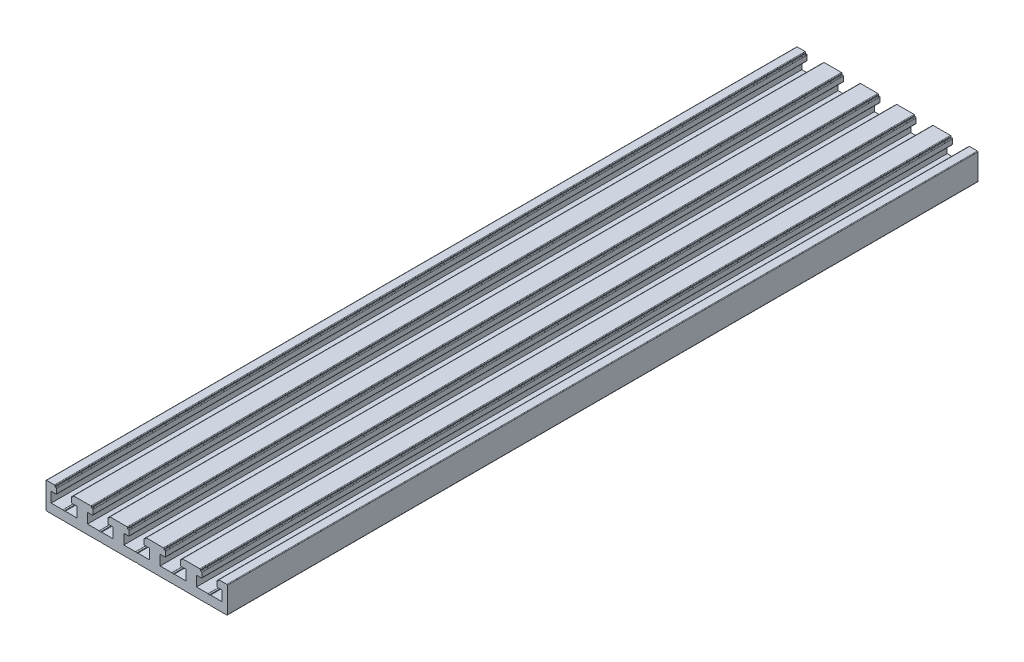
from build123d import *

# Parameters (mm, degrees)
BASE_DEPTH                                      = 310
CSK_FOR_M3_FLAT_HEAD_MACHINE_SCREW1_D           = 3.2
CSK_FOR_M3_FLAT_HEAD_MACHINE_SCREW1_CSINK_D     = 6
CSK_FOR_M3_FLAT_HEAD_MACHINE_SCREW1_CSINK_ANGLE = 90
M4X0_7_TAPPED_HOLE1_D                           = 3.3


with BuildPart() as part:
    # Sketch1 → Base (new body)
    with BuildSketch(Plane(origin=(0, 0, 0), x_dir=(-1, 0, 0), z_dir=(0, 0, -1))):
        with BuildLine():
            Line((-37.45, 8.85), (-37.45, -1.65))
            ThreePointArc((-37.45, -1.65), (-37.376776695, -1.826776695), (-37.2, -1.9))
            Line((-37.2, -1.9), (-30.543629459, -1.9))
            ThreePointArc((-30.543629459, -1.9), (-30.500649598, -1.896277753), (-30.458949592, -1.885221853))
            Line((-30.458949592, -1.885221853), (-30, -1.72))
            Line((-30, -1.72), (-29.541050408, -1.885221853))
            ThreePointArc((-29.541050408, -1.885221853), (-29.499350402, -1.896277753), (-29.456370541, -1.9))
            Line((-29.456370541, -1.9), (-15.543629459, -1.9))
            ThreePointArc((-15.543629459, -1.9), (-15.500649598, -1.896277753), (-15.458949592, -1.885221853))
            Line((-15.458949592, -1.885221853), (-15, -1.72))
            Line((-15, -1.72), (-14.541050408, -1.885221853))
            ThreePointArc((-14.541050408, -1.885221853), (-14.499350402, -1.896277753), (-14.456370541, -1.9))
            Line((-14.456370541, -1.9), (-0.543629459, -1.9))
            ThreePointArc((-0.543629459, -1.9), (-0.500649598, -1.896277753), (-0.458949592, -1.885221853))
            Line((-0.458949592, -1.885221853), (0, -1.72))
            Line((0, -1.72), (0.458949592, -1.885221853))
            ThreePointArc((0.458949592, -1.885221853), (0.500649598, -1.896277753), (0.543629459, -1.9))
            Line((0.543629459, -1.9), (14.456370541, -1.9))
            ThreePointArc((14.456370541, -1.9), (14.499350402, -1.896277753), (14.541050408, -1.885221853))
            Line((14.541050408, -1.885221853), (15, -1.72))
            Line((15, -1.72), (15.458949592, -1.885221853))
            ThreePointArc((15.458949592, -1.885221853), (15.500649598, -1.896277753), (15.543629459, -1.9))
            Line((15.543629459, -1.9), (29.456370541, -1.9))
            ThreePointArc((29.456370541, -1.9), (29.499350402, -1.896277753), (29.541050408, -1.885221853))
            Line((29.541050408, -1.885221853), (30, -1.72))
            Line((30, -1.72), (30.458949592, -1.885221853))
            ThreePointArc((30.458949592, -1.885221853), (30.500649598, -1.896277753), (30.543629459, -1.9))
            Line((30.543629459, -1.9), (37.2, -1.9))
            ThreePointArc((37.2, -1.9), (37.376776695, -1.826776695), (37.45, -1.65))
            Line((37.45, -1.65), (37.45, 8.85))
            ThreePointArc((37.45, 8.85), (37.376776695, 9.026776695), (37.2, 9.1))
            Line((37.2, 9.1), (33.95, 9.1))
            ThreePointArc((33.95, 9.1), (33.773223305, 9.026776695), (33.7, 8.85))
            Line((33.7, 8.85), (33.7, 8.5))
            Line((33.7, 8.5), (33.32, 8.5))
            ThreePointArc((33.32, 8.5), (33.143223305, 8.426776695), (33.07, 8.25))
            Line((33.07, 8.25), (33.07, 6.35))
            ThreePointArc((33.07, 6.35), (33.143223305, 6.173223305), (33.32, 6.1))
            Line((33.32, 6.1), (35.3, 6.1))
            Line((35.3, 6.1), (35.3, 1.9))
            Line((35.3, 1.9), (30.543629459, 1.9))
            ThreePointArc((30.543629459, 1.9), (30.500649598, 1.896277753), (30.458949592, 1.885221853))
            Line((30.458949592, 1.885221853), (30, 1.72))
            Line((30, 1.72), (29.541050408, 1.885221853))
            ThreePointArc((29.541050408, 1.885221853), (29.499350402, 1.896277753), (29.456370541, 1.9))
            Line((29.456370541, 1.9), (24.7, 1.9))
            Line((24.7, 1.9), (24.7, 6.1))
            Line((24.7, 6.1), (26.68, 6.1))
            ThreePointArc((26.68, 6.1), (26.856776695, 6.173223305), (26.93, 6.35))
            Line((26.93, 6.35), (26.93, 8.25))
            ThreePointArc((26.93, 8.25), (26.856776695, 8.426776695), (26.68, 8.5))
            Line((26.68, 8.5), (26.3, 8.5))
            Line((26.3, 8.5), (26.3, 8.85))
            ThreePointArc((26.3, 8.85), (26.226776695, 9.026776695), (26.05, 9.1))
            Line((26.05, 9.1), (18.95, 9.1))
            ThreePointArc((18.95, 9.1), (18.773223305, 9.026776695), (18.7, 8.85))
            Line((18.7, 8.85), (18.7, 8.5))
            Line((18.7, 8.5), (18.32, 8.5))
            ThreePointArc((18.32, 8.5), (18.143223305, 8.426776695), (18.07, 8.25))
            Line((18.07, 8.25), (18.07, 6.35))
            ThreePointArc((18.07, 6.35), (18.143223305, 6.173223305), (18.32, 6.1))
            Line((18.32, 6.1), (20.3, 6.1))
            Line((20.3, 6.1), (20.3, 1.9))
            Line((20.3, 1.9), (15.543629459, 1.9))
            ThreePointArc((15.543629459, 1.9), (15.500649598, 1.896277753), (15.458949592, 1.885221853))
            Line((15.458949592, 1.885221853), (15, 1.72))
            Line((15, 1.72), (14.541050408, 1.885221853))
            ThreePointArc((14.541050408, 1.885221853), (14.499350402, 1.896277753), (14.456370541, 1.9))
            Line((14.456370541, 1.9), (9.7, 1.9))
            Line((9.7, 1.9), (9.7, 6.1))
            Line((9.7, 6.1), (11.68, 6.1))
            ThreePointArc((11.68, 6.1), (11.856776695, 6.173223305), (11.93, 6.35))
            Line((11.93, 6.35), (11.93, 8.25))
            ThreePointArc((11.93, 8.25), (11.856776695, 8.426776695), (11.68, 8.5))
            Line((11.68, 8.5), (11.3, 8.5))
            Line((11.3, 8.5), (11.3, 8.85))
            ThreePointArc((11.3, 8.85), (11.226776695, 9.026776695), (11.05, 9.1))
            Line((11.05, 9.1), (3.95, 9.1))
            ThreePointArc((3.95, 9.1), (3.773223305, 9.026776695), (3.7, 8.85))
            Line((3.7, 8.85), (3.7, 8.5))
            Line((3.7, 8.5), (3.32, 8.5))
            ThreePointArc((3.32, 8.5), (3.143223305, 8.426776695), (3.07, 8.25))
            Line((3.07, 8.25), (3.07, 6.35))
            ThreePointArc((3.07, 6.35), (3.143223305, 6.173223305), (3.32, 6.1))
            Line((3.32, 6.1), (5.3, 6.1))
            Line((5.3, 6.1), (5.3, 1.9))
            Line((5.3, 1.9), (0.543629459, 1.9))
            ThreePointArc((0.543629459, 1.9), (0.500649598, 1.896277753), (0.458949592, 1.885221853))
            Line((0.458949592, 1.885221853), (0, 1.72))
            Line((0, 1.72), (-0.458949592, 1.885221853))
            ThreePointArc((-0.458949592, 1.885221853), (-0.500649598, 1.896277753), (-0.543629459, 1.9))
            Line((-0.543629459, 1.9), (-5.3, 1.9))
            Line((-5.3, 1.9), (-5.3, 6.1))
            Line((-5.3, 6.1), (-3.32, 6.1))
            ThreePointArc((-3.32, 6.1), (-3.143223305, 6.173223305), (-3.07, 6.35))
            Line((-3.07, 6.35), (-3.07, 8.25))
            ThreePointArc((-3.07, 8.25), (-3.143223305, 8.426776695), (-3.32, 8.5))
            Line((-3.32, 8.5), (-3.7, 8.5))
            Line((-3.7, 8.5), (-3.7, 8.85))
            ThreePointArc((-3.7, 8.85), (-3.773223305, 9.026776695), (-3.95, 9.1))
            Line((-3.95, 9.1), (-11.05, 9.1))
            ThreePointArc((-11.05, 9.1), (-11.226776695, 9.026776695), (-11.3, 8.85))
            Line((-11.3, 8.85), (-11.3, 8.5))
            Line((-11.3, 8.5), (-11.68, 8.5))
            ThreePointArc((-11.68, 8.5), (-11.856776695, 8.426776695), (-11.93, 8.25))
            Line((-11.93, 8.25), (-11.93, 6.35))
            ThreePointArc((-11.93, 6.35), (-11.856776695, 6.173223305), (-11.68, 6.1))
            Line((-11.68, 6.1), (-9.7, 6.1))
            Line((-9.7, 6.1), (-9.7, 1.9))
            Line((-9.7, 1.9), (-14.456370541, 1.9))
            ThreePointArc((-14.456370541, 1.9), (-14.499350402, 1.896277753), (-14.541050408, 1.885221853))
            Line((-14.541050408, 1.885221853), (-15, 1.72))
            Line((-15, 1.72), (-15.458949592, 1.885221853))
            ThreePointArc((-15.458949592, 1.885221853), (-15.500649598, 1.896277753), (-15.543629459, 1.9))
            Line((-15.543629459, 1.9), (-20.3, 1.9))
            Line((-20.3, 1.9), (-20.3, 6.1))
            Line((-20.3, 6.1), (-18.32, 6.1))
            ThreePointArc((-18.32, 6.1), (-18.143223305, 6.173223305), (-18.07, 6.35))
            Line((-18.07, 6.35), (-18.07, 8.25))
            ThreePointArc((-18.07, 8.25), (-18.143223305, 8.426776695), (-18.32, 8.5))
            Line((-18.32, 8.5), (-18.7, 8.5))
            Line((-18.7, 8.5), (-18.7, 8.85))
            ThreePointArc((-18.7, 8.85), (-18.773223305, 9.026776695), (-18.95, 9.1))
            Line((-18.95, 9.1), (-26.05, 9.1))
            ThreePointArc((-26.05, 9.1), (-26.226776695, 9.026776695), (-26.3, 8.85))
            Line((-26.3, 8.85), (-26.3, 8.5))
            Line((-26.3, 8.5), (-26.68, 8.5))
            ThreePointArc((-26.68, 8.5), (-26.856776695, 8.426776695), (-26.93, 8.25))
            Line((-26.93, 8.25), (-26.93, 6.35))
            ThreePointArc((-26.93, 6.35), (-26.856776695, 6.173223305), (-26.68, 6.1))
            Line((-26.68, 6.1), (-24.7, 6.1))
            Line((-24.7, 6.1), (-24.7, 1.9))
            Line((-24.7, 1.9), (-29.456370541, 1.9))
            ThreePointArc((-29.456370541, 1.9), (-29.499350402, 1.896277753), (-29.541050408, 1.885221853))
            Line((-29.541050408, 1.885221853), (-30, 1.72))
            Line((-30, 1.72), (-30.458949592, 1.885221853))
            ThreePointArc((-30.458949592, 1.885221853), (-30.500649598, 1.896277753), (-30.543629459, 1.9))
            Line((-30.543629459, 1.9), (-35.3, 1.9))
            Line((-35.3, 1.9), (-35.3, 6.1))
            Line((-35.3, 6.1), (-33.32, 6.1))
            ThreePointArc((-33.32, 6.1), (-33.143223305, 6.173223305), (-33.07, 6.35))
            Line((-33.07, 6.35), (-33.07, 8.25))
            ThreePointArc((-33.07, 8.25), (-33.143223305, 8.426776695), (-33.32, 8.5))
            Line((-33.32, 8.5), (-33.7, 8.5))
            Line((-33.7, 8.5), (-33.7, 8.85))
            ThreePointArc((-33.7, 8.85), (-33.773223305, 9.026776695), (-33.95, 9.1))
            Line((-33.95, 9.1), (-37.2, 9.1))
            ThreePointArc((-37.2, 9.1), (-37.376776695, 9.026776695), (-37.45, 8.85))
        make_face()
    extrude(amount=-BASE_DEPTH)

    # CSK for M3 Flat Head Machine Screw1 (through all)
    with Locations(Plane(origin=(-30, 1.9, 65), x_dir=(0, 0, 1), z_dir=(0, 1, 0))):
        with Locations((0, 0), (0, 60), (214.999942143, 60), (214.999942143, 0)):
            CounterSinkHole(CSK_FOR_M3_FLAT_HEAD_MACHINE_SCREW1_D / 2, CSK_FOR_M3_FLAT_HEAD_MACHINE_SCREW1_CSINK_D / 2, counter_sink_angle=CSK_FOR_M3_FLAT_HEAD_MACHINE_SCREW1_CSINK_ANGLE)

    # M4x0.7 Tapped Hole1 (through all)
    with Locations(Plane(origin=(0, 1.9, 0), x_dir=(1, 0, 0), z_dir=(0, 1, 0))):
        with Locations((15, -30)):
            Hole(M4X0_7_TAPPED_HOLE1_D / 2)


solid = part.part
